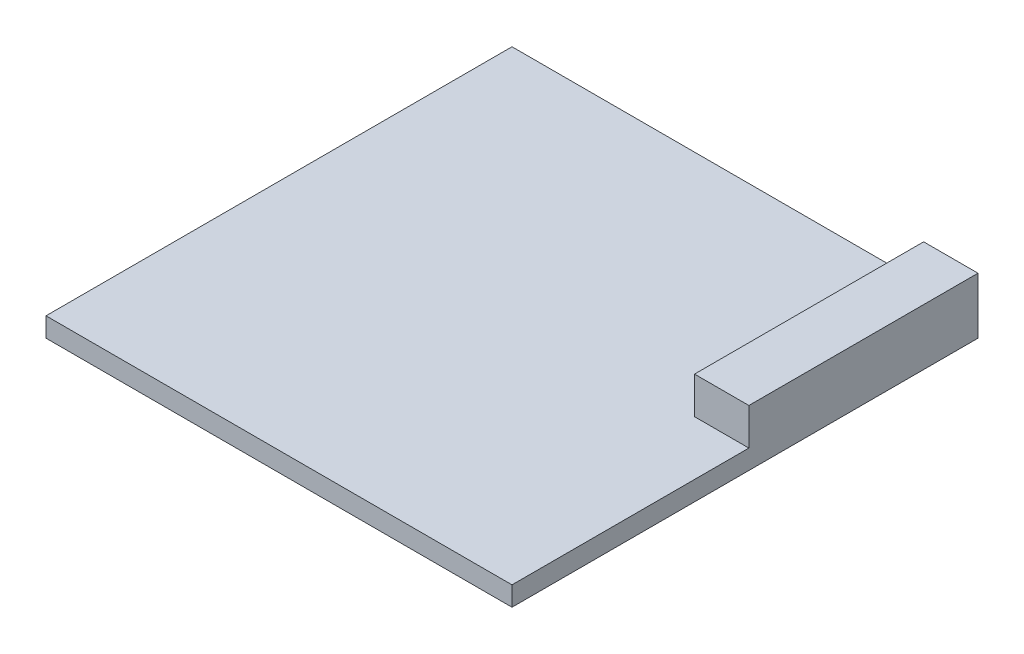
from build123d import *

# Parameters (mm, degrees)
SKETCH1_W           = 609.6
SKETCH1_H           = 609.6
BOSS_EXTRUDE1_DEPTH = 12.7
SKETCH3_W           = 71.12
SKETCH3_H           = 299.72
BOSS_EXTRUDE2_DEPTH = 48.26


with BuildPart() as part:
    # Sketch1 → Boss-Extrude1 (new, symmetric)
    with BuildSketch(Plane(origin=(0, 0, 0), x_dir=(1, 0, 0), z_dir=(0, 1, 0))):
        Rectangle(SKETCH1_W, SKETCH1_H)
    extrude(amount=BOSS_EXTRUDE1_DEPTH, both=True)

    # Sketch3 → Boss-Extrude2 (add)
    with BuildSketch(Plane(origin=(0, 12.7, 0), x_dir=(1, 0, 0), z_dir=(0, 1, 0))):
        with Locations((269.24, 154.94)):
            Rectangle(SKETCH3_W, SKETCH3_H)
    extrude(amount=BOSS_EXTRUDE2_DEPTH)


solid = part.part
